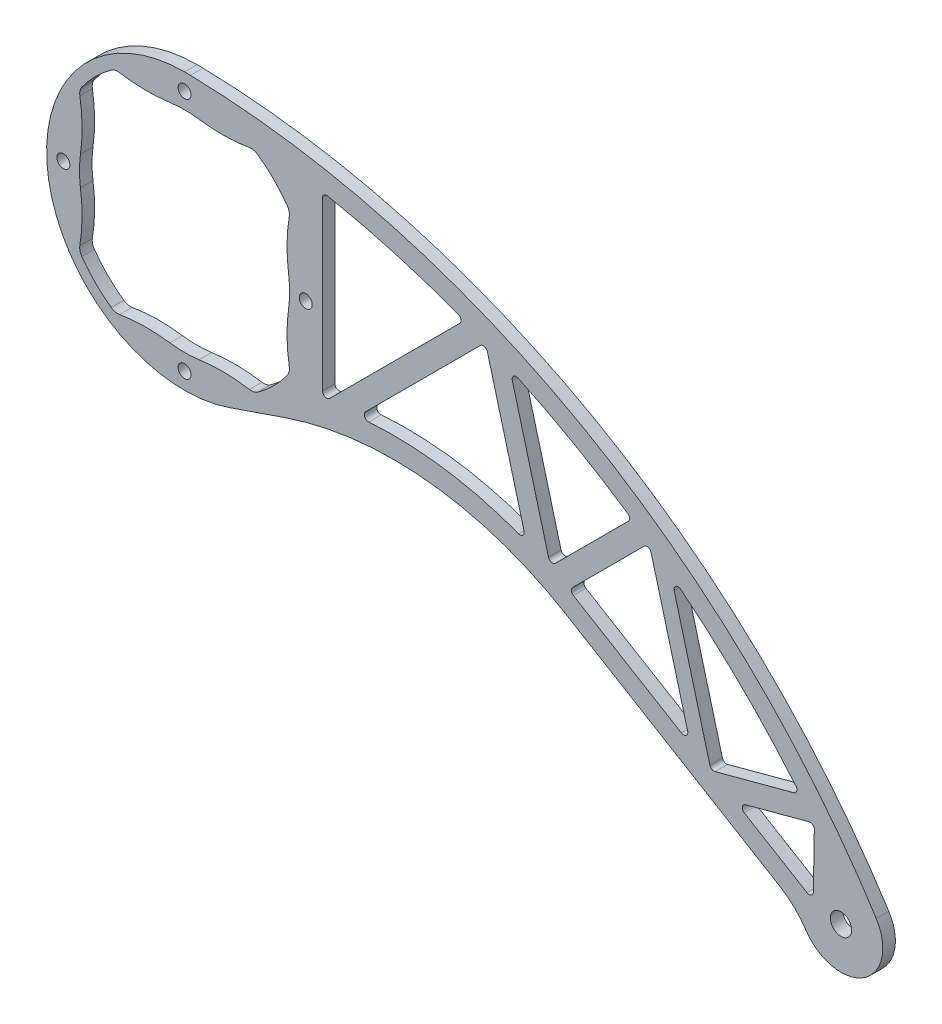
from build123d import *

# Parameters (mm, degrees)
SKETCH_2_R          = 1.55
EXTRUDE_1_DEPTH     = 3
SKETCH_7_R          = 2.55
CUT_EXTRUDE_2_DEPTH = 5
CUT_EXTRUDE_4_DEPTH = 184.170177924
CUT_EXTRUDE_5_DEPTH = 184.170177924


with BuildPart() as part:
    # 草图2 → 凸台-拉伸1 (new body)
    with BuildSketch(Plane.XY):
        with BuildLine():
            Line((10.730362356, -31.206719208), (23.987000349, -26.648453139))
            ThreePointArc((23.987000349, -26.648453139), (58.3964084, -22.742948884), (91.232460283, -33.745404185))
            Line((91.232460283, -33.745404185), (142.367635598, -64.500382059))
            ThreePointArc((142.367635598, -64.500382059), (145.885654628, -67.188078585), (148.726187194, -70.583891486))
            ThreePointArc((148.726187194, -70.583891486), (162.505343691, -73.443257489), (165.49953058, -59.692767585))
            ThreePointArc((165.49953058, -59.692767585), (95.05641772, 7.182197604), (1.414573065, 32.983322541))
            ThreePointArc((1.414573065, 32.983322541), (0.707335687, 32.99583049), (0, 33))
            ThreePointArc((0, 33), (-32.548592395, -5.439589421), (10.730362356, -31.206719208))
        make_face()
        with Locations((-29, 0)):
            Circle(SKETCH_2_R, mode=Mode.SUBTRACT)
        with Locations((0, 29)):
            Circle(SKETCH_2_R, mode=Mode.SUBTRACT)
        with Locations((0, -29)):
            Circle(SKETCH_2_R, mode=Mode.SUBTRACT)
        with Locations((29, 0)):
            Circle(SKETCH_2_R, mode=Mode.SUBTRACT)
        with BuildLine():
            ThreePointArc((-17.479158967, 24.504877103), (-21.283914114, 21.283914114), (-24.504877103, 17.479158967))
            ThreePointArc((-24.504877103, 17.479158967), (-24.920981627, 16.556612715), (-24.953330783, 15.545085111))
            ThreePointArc((-24.953330783, 15.545085111), (-24.421536801, 9.520350069), (-24.806472783, 3.484452336))
            ThreePointArc((-24.806472783, 3.484452336), (-25.05, 0), (-24.806472783, -3.484452336))
            ThreePointArc((-24.806472783, -3.484452336), (-24.421536801, -9.520350069), (-24.953330783, -15.545085111))
            ThreePointArc((-24.953330783, -15.545085111), (-24.920981627, -16.556612715), (-24.504877103, -17.479158967))
            ThreePointArc((-24.504877103, -17.479158967), (-21.283914114, -21.283914114), (-17.479158967, -24.504877103))
            ThreePointArc((-17.479158967, -24.504877103), (-16.556612715, -24.920981627), (-15.545085111, -24.953330783))
            ThreePointArc((-15.545085111, -24.953330783), (-9.520350069, -24.421536801), (-3.484452336, -24.806472783))
            ThreePointArc((-3.484452336, -24.806472783), (0, -25.05), (3.484452336, -24.806472783))
            ThreePointArc((3.484452336, -24.806472783), (9.520350069, -24.421536801), (15.545085111, -24.953330783))
            ThreePointArc((15.545085111, -24.953330783), (16.556612715, -24.920981627), (17.479158967, -24.504877103))
            ThreePointArc((17.479158967, -24.504877103), (21.283914114, -21.283914114), (24.504877103, -17.479158967))
            ThreePointArc((24.504877103, -17.479158967), (24.920981627, -16.556612715), (24.953330783, -15.545085111))
            ThreePointArc((24.953330783, -15.545085111), (24.421536801, -9.520350069), (24.806472783, -3.484452336))
            ThreePointArc((24.806472783, -3.484452336), (25.05, 0), (24.806472783, 3.484452336))
            ThreePointArc((24.806472783, 3.484452336), (24.421536801, 9.520350069), (24.953330783, 15.545085111))
            ThreePointArc((24.953330783, 15.545085111), (24.920981627, 16.556612715), (24.504877103, 17.479158967))
            ThreePointArc((24.504877103, 17.479158967), (21.283914114, 21.283914114), (17.479158967, 24.504877103))
            ThreePointArc((17.479158967, 24.504877103), (16.556612715, 24.920981627), (15.545085111, 24.953330783))
            ThreePointArc((15.545085111, 24.953330783), (9.520350069, 24.421536801), (3.484452336, 24.806472783))
            ThreePointArc((3.484452336, 24.806472783), (0, 25.05), (-3.484452336, 24.806472783))
            ThreePointArc((-3.484452336, 24.806472783), (-9.520350069, 24.421536801), (-15.545085111, 24.953330783))
            ThreePointArc((-15.545085111, 24.953330783), (-16.556612715, 24.920981627), (-17.479158967, 24.504877103))
        make_face(mode=Mode.SUBTRACT)
    extrude(amount=EXTRUDE_1_DEPTH)

    # 草图7 → 切除-拉伸2 (cut)
    with BuildSketch(Plane.XY.offset(3)):
        with Locations((157.059520527, -65.056183502)):
            Circle(SKETCH_7_R)
    extrude(amount=-CUT_EXTRUDE_2_DEPTH, mode=Mode.SUBTRACT)

    # 草图9 → 切除-拉伸4 (cut, through all)
    with BuildSketch(Plane.XY.offset(3)):
        with BuildLine():
            Line((33, 23.419217625), (33, -16.604240946))
            ThreePointArc((33, -16.604240946), (33.617316568, -17.528120479), (34.707106781, -17.311347728))
            Line((34.707106781, -17.311347728), (65.868650079, 13.85019557))
            ThreePointArc((65.868650079, 13.85019557), (66.139078304, 14.768075481), (65.514441307, 15.492964147))
            ThreePointArc((65.514441307, 15.492964147), (50.039622799, 20.601738513), (34.192271497, 24.400559396))
            ThreePointArc((34.192271497, 24.400559396), (33.364496852, 24.191315902), (33, 23.419217625))
        make_face()
        with BuildLine():
            Line((70.777272632, 11.687750311), (43.285444418, -15.804077902))
            ThreePointArc((43.285444418, -15.804077902), (43.082610213, -16.925922432), (44.062405255, -17.508741905))
            ThreePointArc((44.062405255, -17.508741905), (62.271705947, -18.191622153), (79.917026283, -22.739987506))
            ThreePointArc((79.917026283, -22.739987506), (80.940663068, -22.54482321), (81.234917124, -21.545155305))
            Line((81.234917124, -21.545155305), (72.450305239, 11.239462575))
            ThreePointArc((72.450305239, 11.239462575), (71.743198458, 11.946569356), (70.777272632, 11.687750311))
        make_face()
        with BuildLine():
            Line((78.420751264, 8.275971191), (87.070117002, -24.003901194))
            ThreePointArc((87.070117002, -24.003901194), (87.777223783, -24.711007975), (88.743149609, -24.45218893))
            Line((88.743149609, -24.45218893), (106.170669274, -7.024669265))
            ThreePointArc((106.170669274, -7.024669265), (106.459042033, -6.222586245), (106.024202869, -5.489503085))
            ThreePointArc((106.024202869, -5.489503085), (93.207654626, 2.482542409), (79.812900532, 9.439408155))
            ThreePointArc((79.812900532, 9.439408155), (78.745415788, 9.302112816), (78.420751264, 8.275971191))
        make_face()
        with BuildLine():
            Line((109.945638003, -10.320768348), (92.838490747, -27.427915604))
            ThreePointArc((92.838490747, -27.427915604), (92.553025259, -28.256678823), (93.030191775, -28.991968654))
            Line((93.030191775, -28.991968654), (118.888407737, -44.544254432))
            ThreePointArc((118.888407737, -44.544254432), (120.005457191, -44.486072744), (120.369739316, -43.428489117))
            Line((120.369739316, -43.428489117), (111.61867061, -10.769056085))
            ThreePointArc((111.61867061, -10.769056085), (110.911563829, -10.061949303), (109.945638003, -10.320768348))
        make_face()
        with BuildLine():
            Line((117.134569213, -15.899856701), (125.688599687, -47.823933039))
            ThreePointArc((125.688599687, -47.823933039), (126.154525513, -48.431139397), (126.913344559, -48.53103982))
            Line((126.913344559, -48.53103982), (145.779824835, -43.475781666))
            ThreePointArc((145.779824835, -43.475781666), (146.474470094, -42.811361762), (146.288127832, -41.868354653))
            ThreePointArc((146.288127832, -41.868354653), (133.176898235, -27.681248062), (118.726274243, -14.861037407))
            ThreePointArc((118.726274243, -14.861037407), (117.553950154, -14.803607846), (117.134569213, -15.899856701))
        make_face()
        with BuildLine():
            Line((149.412514403, -47.678786332), (134.175652373, -51.761491208))
            ThreePointArc((134.175652373, -51.761491208), (133.444233225, -52.588031523), (133.919065665, -53.584363304))
            Line((133.919065665, -53.584363304), (148.921539819, -62.607521196))
            ThreePointArc((148.921539819, -62.607521196), (149.921379935, -62.625402537), (150.436785689, -61.768456267))
            Line((150.436785689, -61.768456267), (150.671173564, -48.662593499))
            ThreePointArc((150.671173564, -48.662593499), (150.287163938, -47.856833482), (149.412514403, -47.678786332))
        make_face()
    extrude(amount=-CUT_EXTRUDE_4_DEPTH, mode=Mode.SUBTRACT)

    # 草图10 → 切除-拉伸5 (cut, through all)
    with BuildSketch(Plane.XY.offset(3)):
        with BuildLine():
            ThreePointArc((-3.498362326, -24.905500618), (-9.519132496, -24.521529388), (-15.52876795, -25.051990553))
            ThreePointArc((-15.52876795, -25.051990553), (-16.579200462, -25.018397199), (-17.537229262, -24.586288654))
            ThreePointArc((-17.537229262, -24.586288654), (-21.354624792, -21.354624792), (-24.586288654, -17.537229262))
            ThreePointArc((-24.586288654, -17.537229262), (-25.018397199, -16.579200462), (-25.051990553, -15.52876795))
            ThreePointArc((-25.051990553, -15.52876795), (-24.521529388, -9.519132496), (-24.905500618, -3.498362326))
            ThreePointArc((-24.905500618, -3.498362326), (-25.15, 0), (-24.905500618, 3.498362326))
            ThreePointArc((-24.905500618, 3.498362326), (-24.521529388, 9.519132496), (-25.051990553, 15.52876795))
            ThreePointArc((-25.051990553, 15.52876795), (-25.018397199, 16.579200462), (-24.586288654, 17.537229262))
            ThreePointArc((-24.586288654, 17.537229262), (-21.354624792, 21.354624792), (-17.537229262, 24.586288654))
            ThreePointArc((-17.537229262, 24.586288654), (-16.579200462, 25.018397199), (-15.52876795, 25.051990553))
            ThreePointArc((-15.52876795, 25.051990553), (-9.519132496, 24.521529388), (-3.498362326, 24.905500618))
            ThreePointArc((-3.498362326, 24.905500618), (0, 25.15), (3.498362326, 24.905500618))
            ThreePointArc((3.498362326, 24.905500618), (9.519132496, 24.521529388), (15.52876795, 25.051990553))
            ThreePointArc((15.52876795, 25.051990553), (16.579200462, 25.018397199), (17.537229262, 24.586288654))
            ThreePointArc((17.537229262, 24.586288654), (21.354624792, 21.354624792), (24.586288654, 17.537229262))
            ThreePointArc((24.586288654, 17.537229262), (25.018397199, 16.579200462), (25.051990553, 15.52876795))
            ThreePointArc((25.051990553, 15.52876795), (24.521529388, 9.519132496), (24.905500618, 3.498362326))
            ThreePointArc((24.905500618, 3.498362326), (25.15, 0), (24.905500618, -3.498362326))
            ThreePointArc((24.905500618, -3.498362326), (24.521529388, -9.519132496), (25.051990553, -15.52876795))
            ThreePointArc((25.051990553, -15.52876795), (25.018397199, -16.579200462), (24.586288654, -17.537229262))
            ThreePointArc((24.586288654, -17.537229262), (21.354624792, -21.354624792), (17.537229262, -24.586288654))
            ThreePointArc((17.537229262, -24.586288654), (16.579200462, -25.018397199), (15.52876795, -25.051990553))
            ThreePointArc((15.52876795, -25.051990553), (9.519132496, -24.521529388), (3.498362326, -24.905500618))
            ThreePointArc((3.498362326, -24.905500618), (0, -25.15), (-3.498362326, -24.905500618))
        make_face()
    extrude(amount=-CUT_EXTRUDE_5_DEPTH, mode=Mode.SUBTRACT)


with BuildPart() as body_2:
    # 镜向1: mirrored copy
    add(part.part.mirror(Plane(origin=(132.059520527, -81.639307454, 3), x_dir=(1, 0, 0), z_dir=(0, 0, -1))))


solid = body_2.part
